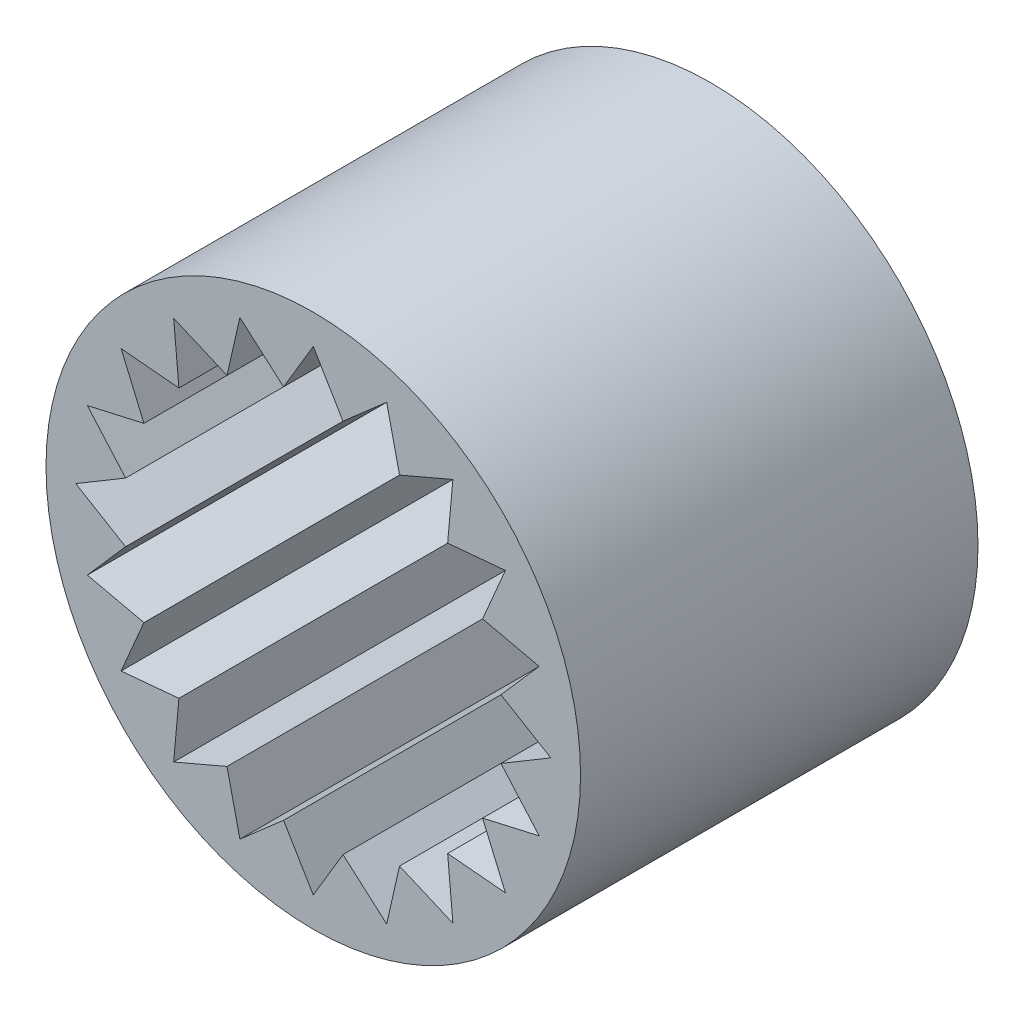
from build123d import *

# Parameters (mm, degrees)
SERVOSPLINEPROFILE_R = 3.362297175
SERVOKEY_DEPTH       = 5


with BuildPart() as part:
    # ServoSplineProfile → ServoKey (new body)
    with BuildSketch(Plane.XY):
        Circle(SERVOSPLINEPROFILE_R)
        Polygon((0.214716449, 2.628050171), (0.373952201, 2.361041273), (0.923370571, 2.841842406), (1.085251555, 2.129926103), (1.756355197, 2.41741554), (1.690318926, 1.690318926), (2.41741554, 1.756355197), (2.129926103, 1.085251555), (2.841842406, 0.923370571), (2.361041273, 0.373952201), (2.988089937, 0), (2.361041273, -0.373952201), (2.841842406, -0.923370571), (2.129926103, -1.085251555), (2.41741554, -1.756355197), (1.690318926, -1.690318926), (1.756355197, -2.41741554), (1.085251555, -2.129926103), (0.923370571, -2.841842406), (0.373952201, -2.361041273), (0, -2.988089937), (-0.373952201, -2.361041273), (-0.923370571, -2.841842406), (-1.085251555, -2.129926103), (-1.756355197, -2.41741554), (-1.690318926, -1.690318926), (-2.41741554, -1.756355197), (-2.129926103, -1.085251555), (-2.841842406, -0.923370571), (-2.361041273, -0.373952201), (-2.988089937, 0), (-2.361041273, 0.373952201), (-2.841842406, 0.923370571), (-2.129926103, 1.085251555), (-2.41741554, 1.756355197), (-1.690318926, 1.690318926), (-1.756355197, 2.41741554), (-1.085251555, 2.129926103), (-0.923370571, 2.841842406), (-0.373952201, 2.361041273), (-0.214716449, 2.628050171), (0, 2.988089937), align=None, mode=Mode.SUBTRACT)
    extrude(amount=SERVOKEY_DEPTH)


solid = part.part
